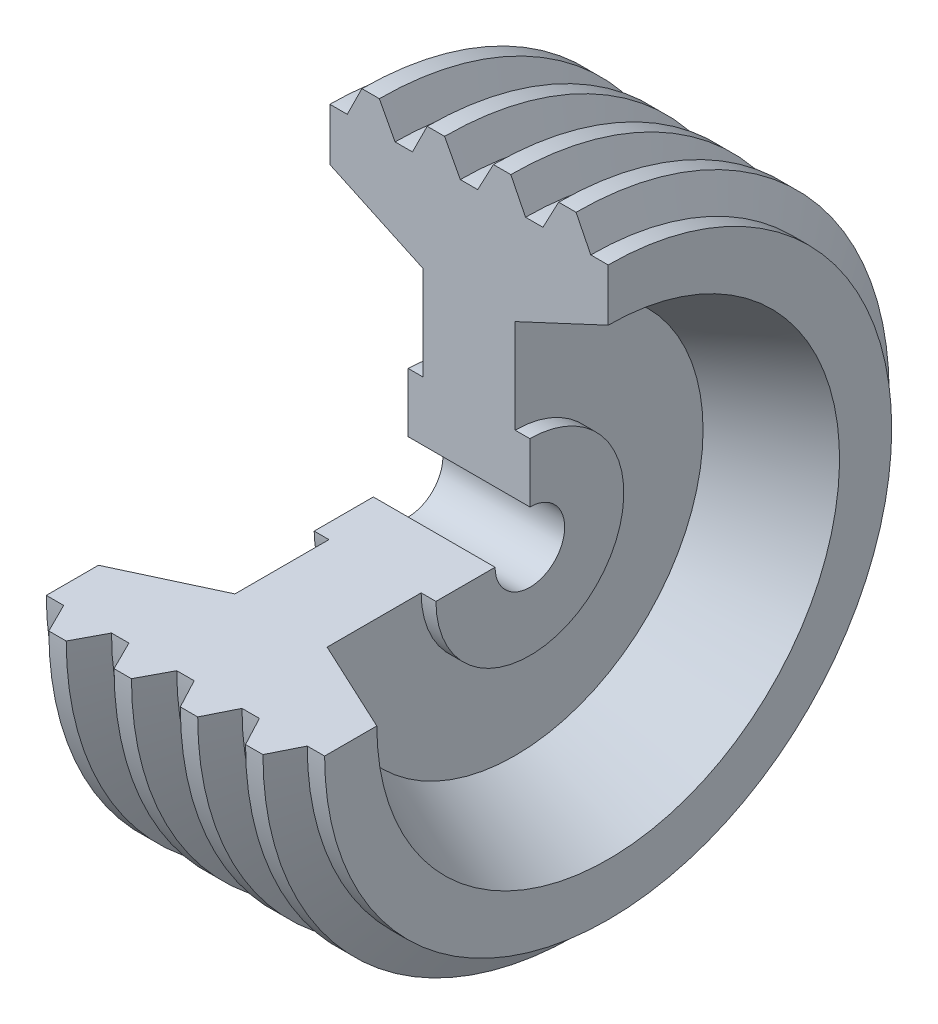
from build123d import *

# Parameters (mm, degrees)
REVOLVE1_ANGLE = 270


with BuildPart() as part:
    # Sketch1 → Revolve1 (revolve)
    with BuildSketch(Plane.XY):
        Polygon((-35, 20), (35, 20), (35, 54), (26.5, 54), (26.5, 108.052540289), (80, 133), (80, 163), (70, 163), (61.539060338, 180), (51.539060338, 180), (42.5, 163), (32.5, 163), (24.039060338, 180), (14.039060338, 180), (5, 163), (-5, 163), (-14.039060338, 180), (-24.039060338, 180), (-32.5, 163), (-42.5, 163), (-51.539060338, 180), (-61.539060338, 180), (-70, 163), (-80, 163), (-80, 133), (-26.5, 108.052540289), (-26.5, 54), (-35, 54), align=None)
    revolve(axis=Axis((0, 0, 0), (-1, 0, 0)), revolution_arc=REVOLVE1_ANGLE)


solid = part.part
